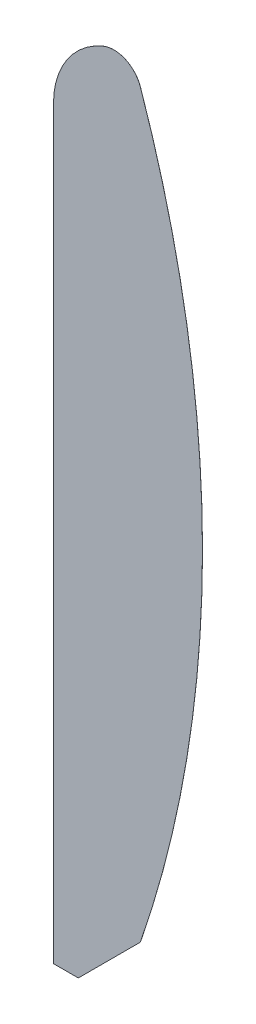
from build123d import *

# Parameters (mm, degrees)
BOSS_EXTRUDE1_DEPTH = 0.01


with BuildPart() as part:
    # Sketch1 → Boss-Extrude1 (new body)
    with BuildSketch(Plane(origin=(0, 0, 0), x_dir=(0, 1, 0), z_dir=(0, 0, 1))):
        with BuildLine():
            Line((0, 0), (150, 0))
            ThreePointArc((150, 0), (159.013878189, -2.729182717), (165, -10))
            ThreePointArc((165, -10), (164.939268885, -14.478297905), (161.633492601, -17.5))
            ThreePointArc((161.633492601, -17.5), (87.0667463, -30), (12.5, -17.5))
            Line((12.5, -17.5), (0, -5))
            Line((0, -5), (0, 0))
        make_face()
    extrude(amount=BOSS_EXTRUDE1_DEPTH)


solid = part.part
